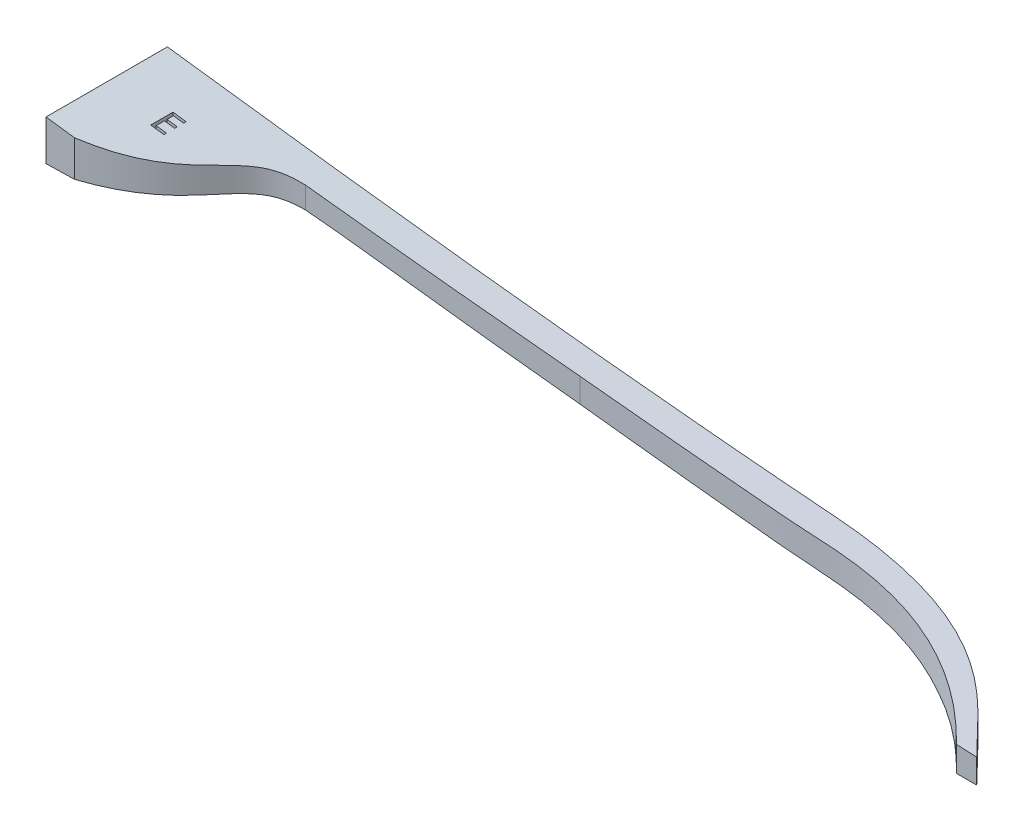
from build123d import *

# Parameters (mm, degrees)
SKETCH1_W           = 146.05
SKETCH1_H           = 19.05
BOSS_EXTRUDE1_DEPTH = 17.78
CUT_EXTRUDE5_DEPTH  = 1.905
CUT_EXTRUDE2_DEPTH  = 19.05
CUT_EXTRUDE3_DEPTH  = 149.356440496
SKETCH5_W           = 6.985
SKETCH5_H           = 3.81
CUT_EXTRUDE4_DEPTH  = 6.35


with BuildPart() as part:
    # Sketch1 → Boss-Extrude1 (new body)
    with BuildSketch(Plane(origin=(0, 0, 0), x_dir=(1, 0, 0), z_dir=(0, 1, 0))):
        with Locations((73.025, 9.525)):
            Rectangle(SKETCH1_W, SKETCH1_H)
    extrude(amount=BOSS_EXTRUDE1_DEPTH)

    # Sketch6 → Cut-Extrude5 (cut)
    with BuildSketch(Plane(origin=(0, 17.78, 0), x_dir=(1, 0, 0), z_dir=(0, 1, 0))):
        Polygon((8.235244611, 11.699320572), (10.299347175, 11.699320572), (10.299347175, 11.295474418), (8.68396256, 11.295474418), (8.68396256, 10.308294931), (10.299347175, 10.308294931), (10.299347175, 9.904448777), (8.68396256, 9.904448777), (8.68396256, 8.603166726), (10.299347175, 8.603166726), (10.299347175, 8.199320572), (8.235244611, 8.199320572), align=None)
    extrude(amount=-CUT_EXTRUDE5_DEPTH, mode=Mode.SUBTRACT)

    # Sketch4 → Cut-Extrude2 (cut)
    with BuildSketch(Plane(origin=(0, 17.78, 0), x_dir=(1, 0, 0), z_dir=(0, 1, 0))):
        with BuildLine():
            add(Edge.make_bspline(
                [(4.476723392, 0), (17.725756487, 4.043101895), (17.090749047, 12.999753789), (25.262791442, 14.373397692), (26.219517358, 14.465775476)],
                knots=[0, 0, 0, 0, 0.256127126, 0.284585695, 0.284585695, 0.284585695, 0.284585695], degree=3))
            Line((4.476723392, 0), (142.875, 0))
            add(Edge.make_bspline(
                [(68.923918907, 14.861089556), (81.075041449, 14.855684794), (98.246564786, 14.797098309), (108.068516517, 14.713978549), (127.226778846, 16.049688466), (142.875, 0)],
                knots=[0.488488537, 0.488488537, 0.488488537, 0.488488537, 0.629203286, 0.700744717, 1, 1, 1, 1], degree=3))
            Line((68.923918907, 14.861089556), (26.219517358, 14.465775476))
        make_face()
        with BuildLine():
            add(Edge.make_bspline(
                [(105.157866441, 19.05), (131.491281961, 18.918345897), (139.296835945, 6.588803862), (146.05, 0)],
                knots=[0.010622627, 0.010622627, 0.010622627, 0.010622627, 1, 1, 1, 1], degree=3))
            Line((146.05, 0), (146.05, 19.05))
            Line((146.05, 19.05), (105.157866441, 19.05))
        make_face()
    extrude(amount=-CUT_EXTRUDE2_DEPTH, mode=Mode.SUBTRACT)

    # Sketch3 → Cut-Extrude3 (cut, through all)
    with BuildSketch(Plane(origin=(0, 0, -19.05), x_dir=(-1, 0, 0), z_dir=(0, 0, -1))):
        with BuildLine():
            Line((0, 0), (0, 11.43))
            add(Edge.make_bspline(
                [(0, 11.43), (-27.212978315, 12.141866266), (-25.699255583, 10.135880462), (-111.819871073, 1.097438505), (-130.705361789, 0)],
                knots=[0, 0, 0, 0, 0.551607579, 0.868087195, 0.868087195, 0.868087195, 0.868087195], degree=3))
            Line((-130.705361789, 0), (0, 0))
        make_face()
        with BuildLine():
            add(Edge.make_bspline(
                [(0, 17.78), (-48.481130749, 11.376451851), (-97.167750981, 5.912650085), (-146.05, 3.81)],
                knots=[0, 0, 0, 0, 1, 1, 1, 1], degree=3))
            Line((0, 17.78), (-146.05, 17.78))
            Line((-146.05, 17.78), (-146.05, 3.81))
        make_face()
    extrude(amount=-CUT_EXTRUDE3_DEPTH, mode=Mode.SUBTRACT)

    # Sketch5 → Cut-Extrude4 (cut)
    with BuildSketch(Plane.ZY):
        with Locations((-9.2075, 13.335)):
            Rectangle(SKETCH5_W, SKETCH5_H)
    extrude(amount=-CUT_EXTRUDE4_DEPTH, mode=Mode.SUBTRACT)


solid = part.part
